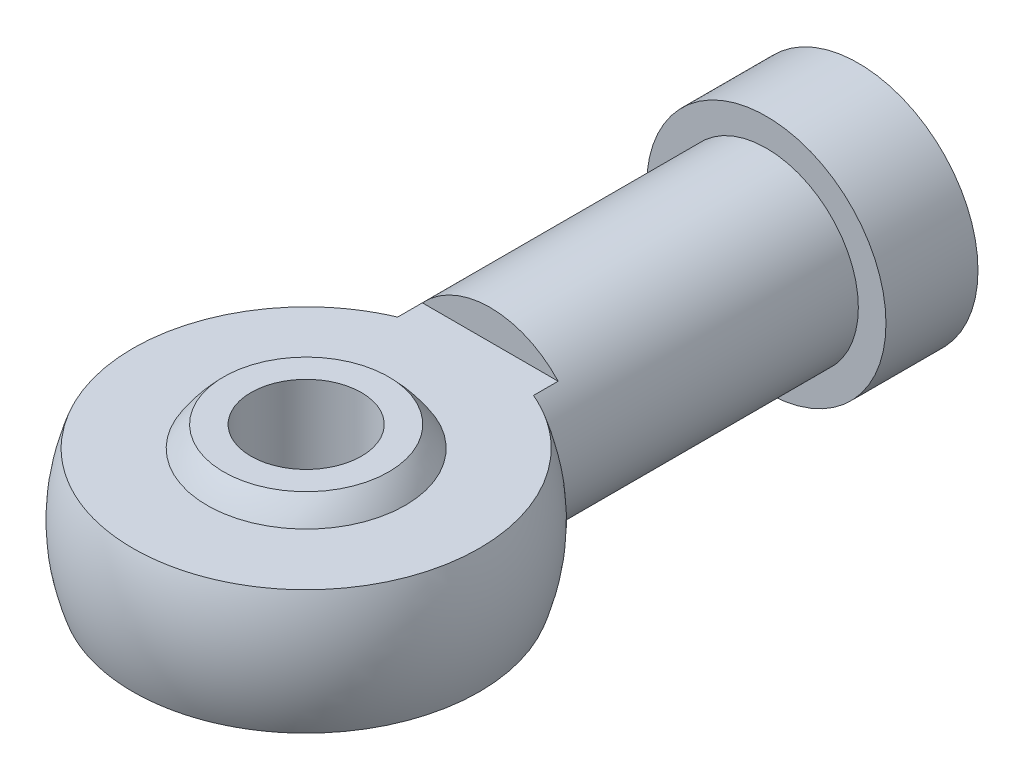
from build123d import *

# Parameters (mm, degrees)
SKETCH_3_R                   = 6.5
EXTRUDE_1_DEPTH              = 5
SKETCH_4_R                   = 5
EXTRUDE_2_DEPTH              = 20
SKETCH_6_W                   = 25
SKETCH_6_H                   = 25
SKETCH_6_W_2                 = 24
SKETCH_6_H_2                 = 6.75
CUT_EXTRUDE_1_DEPTH          = 25
CUT_EXTRUDE_3_DEPTH          = 42.740268327
CUT_EXTRUDE_3_DEPTH_BACK     = 42.740268327
SKETCH_10_R                  = 3
HOLE_WIZARD_M6_1_D           = 5
HOLE_WIZARD_M6_1_DEPTH       = 15
HOLE_WIZARD_M6_1_CSINK_D     = 6.05
HOLE_WIZARD_M6_1_CSINK_ANGLE = 90
HOLE_WIZARD_M6_1_TIP         = 1.502151548
SKETCH_16_R                  = 20
SKETCH_16_W                  = 25
SKETCH_16_H                  = 9
CUT_EXTRUDE_4_DEPTH          = 24.286262044


with BuildPart() as part:
    # 草图3 → 凸台-拉伸1 (new body)
    with BuildSketch(Plane.XY):
        Circle(SKETCH_3_R)
    extrude(amount=EXTRUDE_1_DEPTH)

    # 草图4 → 凸台-拉伸2 (add)
    with BuildSketch(Plane.XY.offset(5)):
        Circle(SKETCH_4_R)
    extrude(amount=EXTRUDE_2_DEPTH)

    # 草图5 → 旋转4 (revolve)
    with BuildSketch(Plane(origin=(0, 0, 0), x_dir=(1, 0, 0), z_dir=(0, 1, 0))):
        with BuildLine():
            Line((0, -20), (0, -40))
            ThreePointArc((0, -40), (-10, -30), (0, -20))
        make_face()
    revolve(axis=Axis((0, 0, 0), (0, 0, 1)))

    # 草图6 → 切除-拉伸1 (cut)
    with BuildSketch(Plane.XY.offset(20)):
        Rectangle(SKETCH_6_W, SKETCH_6_H)
        Rectangle(SKETCH_6_W_2, SKETCH_6_H_2, mode=Mode.SUBTRACT)
    extrude(amount=CUT_EXTRUDE_1_DEPTH, mode=Mode.SUBTRACT)

    # 草图8 → 旋转5 (revolve)
    with BuildSketch(Plane(origin=(0, 0, 0), x_dir=(1, 0, 0), z_dir=(0, 1, 0))):
        with BuildLine():
            Line((-6.35, -30), (6.35, -30))
            ThreePointArc((6.35, -30), (0, -36.35), (-6.35, -30))
        make_face()
    revolve(axis=Axis((-10, 0, 30), (1, 0, 0)))

    # 草图10 → 切除-拉伸3 (cut, two sides: drawn at the far end of the back side and taken through both)
    with BuildSketch(Plane(origin=(0, 0, 0), x_dir=(1, 0, 0), z_dir=(0, 1, 0)).offset(-CUT_EXTRUDE_3_DEPTH_BACK)):
        with Locations(Location((0, -30, 0), (0, 0, 180))):
            Circle(SKETCH_10_R)
    extrude(amount=CUT_EXTRUDE_3_DEPTH + CUT_EXTRUDE_3_DEPTH_BACK, mode=Mode.SUBTRACT)

    # M6 螺纹孔1
    with Locations(Plane(origin=(0, 0, 0), x_dir=(-1, 0, 0), z_dir=(0, 0, -1))):
        with Locations((0, 0)):
            CounterSinkHole(HOLE_WIZARD_M6_1_D / 2, HOLE_WIZARD_M6_1_CSINK_D / 2, depth=HOLE_WIZARD_M6_1_DEPTH, counter_sink_angle=HOLE_WIZARD_M6_1_CSINK_ANGLE)
            with Locations((0, 0, -(HOLE_WIZARD_M6_1_DEPTH + HOLE_WIZARD_M6_1_TIP / 2))):  # 118° drill point
                Cone(0, HOLE_WIZARD_M6_1_D / 2, HOLE_WIZARD_M6_1_TIP, mode=Mode.SUBTRACT)

    # 草图16 → 切除-拉伸4 (cut, through all)
    with BuildSketch(Plane.XY.offset(20)):
        Circle(SKETCH_16_R)
        Rectangle(SKETCH_16_W, SKETCH_16_H, mode=Mode.SUBTRACT)
    extrude(amount=CUT_EXTRUDE_4_DEPTH, mode=Mode.SUBTRACT)


solid = part.part
